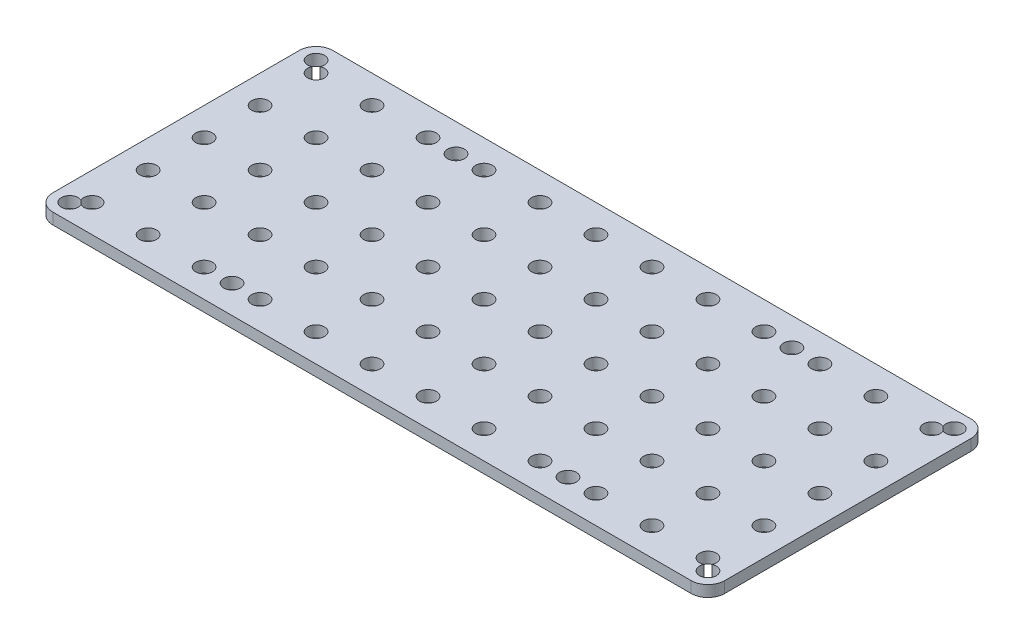
from build123d import *

# Parameters (mm, degrees)
SKETCH_1_W          = 120
SKETCH_1_H          = 50
EXTRUDE_1_DEPTH     = 2
SKETCH_2_R          = 1.5
CUT_EXTRUDE_1_DEPTH = 66.030761952
FILLET_1_R          = 3
SKETCH_3_R          = 1.5
CUT_EXTRUDE_2_DEPTH = 66.030761952


with BuildPart() as part:
    # 草图1 → 凸台-拉伸1 (new body)
    with BuildSketch(Plane(origin=(0, 0, 0), x_dir=(1, 0, 0), z_dir=(0, 1, 0))):
        Rectangle(SKETCH_1_W, SKETCH_1_H)
    extrude(amount=EXTRUDE_1_DEPTH)

    # 草图2 → 切除-拉伸1 (cut, through all)
    with BuildSketch(Plane(origin=(0, 2, 0), x_dir=(1, 0, 0), z_dir=(0, 1, 0))):
        with Locations(Location((-30, 20, 0), (0, 0, 270))):
            Circle(SKETCH_2_R)
        with Locations(Location((-55, 0, 0), (0, 0, 270))):
            Circle(SKETCH_2_R)
        with Locations(Location((-30, -20, 0), (0, 0, 90))):
            Circle(SKETCH_2_R)
        with Locations(Location((30, -20, 0), (0, 0, 270))):
            Circle(SKETCH_2_R)
        with Locations(Location((55, 0, 0), (0, 0, 90))):
            Circle(SKETCH_2_R)
        with Locations(Location((30, 20, 0), (0, 0, 90))):
            Circle(SKETCH_2_R)
        with Locations(Location((-57, 22, 0), (0, 0, 270))):
            Circle(SKETCH_2_R)
        with Locations(Location((-57, -22, 0), (0, 0, 90))):
            Circle(SKETCH_2_R)
        with Locations(Location((57, -22, 0), (0, 0, 270))):
            Circle(SKETCH_2_R)
        with Locations(Location((57, 22, 0), (0, 0, 90))):
            Circle(SKETCH_2_R)
    extrude(amount=-CUT_EXTRUDE_1_DEPTH, mode=Mode.SUBTRACT)

    # 圆角1
    fillet_1_edges = [part.edges().sort_by_distance(p)[0] for p in [
        (60, 1, 25),
        (-60, 1, 25),
        (-60, 1, -25),
        (60, 1, -25),
    ]]
    fillet(fillet_1_edges, radius=FILLET_1_R)

    # 草图3 → 切除-拉伸2 (cut, through all)
    with BuildSketch(Plane(origin=(0, 2, 0), x_dir=(1, 0, 0), z_dir=(0, 1, 0))):
        with Locations((-55, 20)):
            Circle(SKETCH_3_R)
        with Locations(Location((-45, 20, 0), (0, 0, 270))):
            Circle(SKETCH_3_R)
        with Locations(Location((-35, 20, 0), (0, 0, 270))):
            Circle(SKETCH_3_R)
        with Locations(Location((-25, 20, 0), (0, 0, 270))):
            Circle(SKETCH_3_R)
        with Locations(Location((-15, 20, 0), (0, 0, 270))):
            Circle(SKETCH_3_R)
        with Locations(Location((-5, 20, 0), (0, 0, 270))):
            Circle(SKETCH_3_R)
        with Locations(Location((5, 20, 0), (0, 0, 270))):
            Circle(SKETCH_3_R)
        with Locations(Location((15, 20, 0), (0, 0, 270))):
            Circle(SKETCH_3_R)
        with Locations(Location((25, 20, 0), (0, 0, 270))):
            Circle(SKETCH_3_R)
        with Locations(Location((35, 20, 0), (0, 0, 270))):
            Circle(SKETCH_3_R)
        with Locations(Location((45, 20, 0), (0, 0, 270))):
            Circle(SKETCH_3_R)
        with Locations((55, 20)):
            Circle(SKETCH_3_R)
        with Locations(Location((-45, 10, 0), (0, 0, 270))):
            Circle(SKETCH_3_R)
        with Locations(Location((-35, 10, 0), (0, 0, 270))):
            Circle(SKETCH_3_R)
        with Locations(Location((-25, 10, 0), (0, 0, 270))):
            Circle(SKETCH_3_R)
        with Locations(Location((-15, 10, 0), (0, 0, 270))):
            Circle(SKETCH_3_R)
        with Locations(Location((-5, 10, 0), (0, 0, 270))):
            Circle(SKETCH_3_R)
        with Locations(Location((5, 10, 0), (0, 0, 270))):
            Circle(SKETCH_3_R)
        with Locations(Location((15, 10, 0), (0, 0, 270))):
            Circle(SKETCH_3_R)
        with Locations(Location((25, 10, 0), (0, 0, 270))):
            Circle(SKETCH_3_R)
        with Locations(Location((35, 10, 0), (0, 0, 270))):
            Circle(SKETCH_3_R)
        with Locations(Location((45, 10, 0), (0, 0, 270))):
            Circle(SKETCH_3_R)
        with Locations(Location((55, 10, 0), (0, 0, 270))):
            Circle(SKETCH_3_R)
        with Locations(Location((-45, 0, 0), (0, 0, 270))):
            Circle(SKETCH_3_R)
        with Locations(Location((-35, 0, 0), (0, 0, 270))):
            Circle(SKETCH_3_R)
        with Locations(Location((-25, 0, 0), (0, 0, 270))):
            Circle(SKETCH_3_R)
        with Locations(Location((-15, 0, 0), (0, 0, 270))):
            Circle(SKETCH_3_R)
        with Locations(Location((-5, 0, 0), (0, 0, 270))):
            Circle(SKETCH_3_R)
        with Locations(Location((5, 0, 0), (0, 0, 270))):
            Circle(SKETCH_3_R)
        with Locations(Location((15, 0, 0), (0, 0, 270))):
            Circle(SKETCH_3_R)
        with Locations(Location((25, 0, 0), (0, 0, 270))):
            Circle(SKETCH_3_R)
        with Locations(Location((35, 0, 0), (0, 0, 270))):
            Circle(SKETCH_3_R)
        with Locations(Location((45, 0, 0), (0, 0, 270))):
            Circle(SKETCH_3_R)
        with Locations(Location((55, 0, 0), (0, 0, 90))):
            Circle(SKETCH_3_R)
        with Locations(Location((-45, -10, 0), (0, 0, 270))):
            Circle(SKETCH_3_R)
        with Locations(Location((-35, -10, 0), (0, 0, 270))):
            Circle(SKETCH_3_R)
        with Locations(Location((-25, -10, 0), (0, 0, 270))):
            Circle(SKETCH_3_R)
        with Locations(Location((-15, -10, 0), (0, 0, 270))):
            Circle(SKETCH_3_R)
        with Locations(Location((-5, -10, 0), (0, 0, 270))):
            Circle(SKETCH_3_R)
        with Locations(Location((5, -10, 0), (0, 0, 270))):
            Circle(SKETCH_3_R)
        with Locations(Location((15, -10, 0), (0, 0, 270))):
            Circle(SKETCH_3_R)
        with Locations(Location((25, -10, 0), (0, 0, 270))):
            Circle(SKETCH_3_R)
        with Locations(Location((35, -10, 0), (0, 0, 270))):
            Circle(SKETCH_3_R)
        with Locations(Location((45, -10, 0), (0, 0, 270))):
            Circle(SKETCH_3_R)
        with Locations(Location((55, -10, 0), (0, 0, 270))):
            Circle(SKETCH_3_R)
        with Locations(Location((-45, -20, 0), (0, 0, 270))):
            Circle(SKETCH_3_R)
        with Locations(Location((-35, -20, 0), (0, 0, 270))):
            Circle(SKETCH_3_R)
        with Locations(Location((-25, -20, 0), (0, 0, 270))):
            Circle(SKETCH_3_R)
        with Locations(Location((-15, -20, 0), (0, 0, 270))):
            Circle(SKETCH_3_R)
        with Locations(Location((-5, -20, 0), (0, 0, 270))):
            Circle(SKETCH_3_R)
        with Locations(Location((5, -20, 0), (0, 0, 270))):
            Circle(SKETCH_3_R)
        with Locations(Location((15, -20, 0), (0, 0, 270))):
            Circle(SKETCH_3_R)
        with Locations(Location((25, -20, 0), (0, 0, 270))):
            Circle(SKETCH_3_R)
        with Locations(Location((35, -20, 0), (0, 0, 270))):
            Circle(SKETCH_3_R)
        with Locations(Location((45, -20, 0), (0, 0, 270))):
            Circle(SKETCH_3_R)
        with Locations((55, -20)):
            Circle(SKETCH_3_R)
        with Locations(Location((-55, 10, 0), (0, 0, 270))):
            Circle(SKETCH_3_R)
        with Locations(Location((-55, 0, 0), (0, 0, 270))):
            Circle(SKETCH_3_R)
        with Locations(Location((-55, -10, 0), (0, 0, 270))):
            Circle(SKETCH_3_R)
        with Locations((-55, -20)):
            Circle(SKETCH_3_R)
    extrude(amount=-CUT_EXTRUDE_2_DEPTH, mode=Mode.SUBTRACT)


solid = part.part
